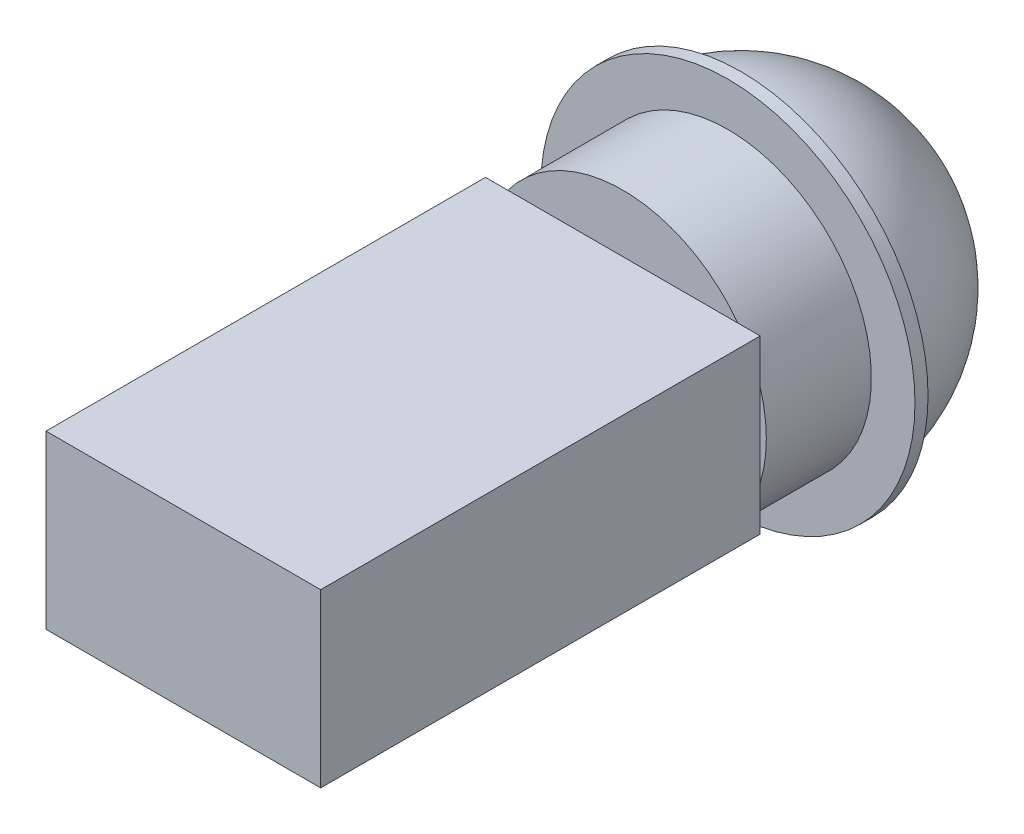
from build123d import *

# Parameters (mm, degrees)
SKETCH2_W           = 10.16
SKETCH2_H           = 6.35
BOSS_EXTRUDE1_DEPTH = 16.256


with BuildPart() as part:
    # Sketch1 → Revolve1 (revolve)
    with BuildSketch(Plane(origin=(0, 0, 0), x_dir=(1, 0, 0), z_dir=(0, 1, 0))):
        with BuildLine():
            Line((0, 6.20395), (0, -4.3688))
            Line((0, -4.3688), (-5.3086, -4.3688))
            Line((-5.3086, -4.3688), (-5.3086, -0.4826))
            Line((-5.3086, -0.4826), (-6.9215, -0.4826))
            Line((-6.9215, -0.4826), (-6.9215, 0))
            Line((-6.9215, 0), (-6.20395, 0))
            ThreePointArc((-6.20395, 0), (-4.386855115, 4.386855115), (0, 6.20395))
        make_face()
    revolve(axis=Axis((0, 0, -6.20395), (0, 0, 1)))

    # Sketch2 → Boss-Extrude1 (add)
    with BuildSketch(Plane.XY.offset(4.3688)):
        Rectangle(SKETCH2_W, SKETCH2_H)
    extrude(amount=BOSS_EXTRUDE1_DEPTH)


solid = part.part
